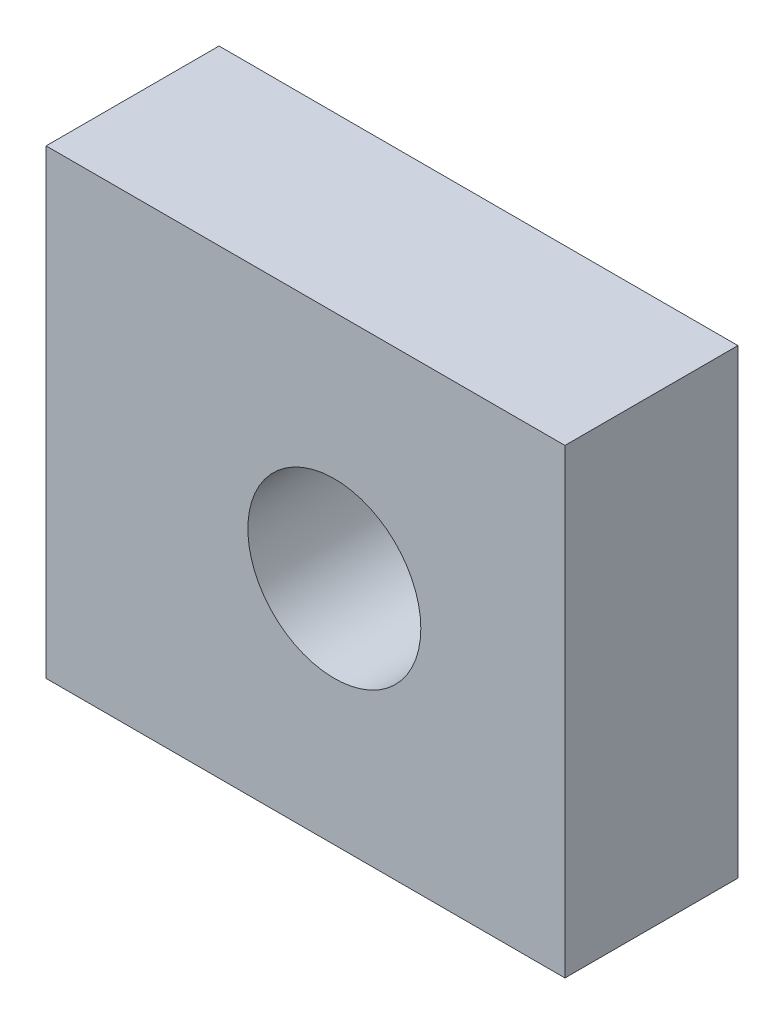
from build123d import *

# Parameters (mm, degrees)
SKETCH_1_W          = 9
SKETCH_1_H          = 8
EXTRUDE_1_DEPTH     = 3
SKETCH_2_R          = 1.5
CUT_EXTRUDE_1_DEPTH = 13.409673646


with BuildPart() as part:
    # Эскиз1 → Бобышка-Вытянуть1 (new body)
    with BuildSketch(Plane.XY):
        with Locations((4.5, 4)):
            Rectangle(SKETCH_1_W, SKETCH_1_H)
    extrude(amount=EXTRUDE_1_DEPTH)

    # Эскиз2 → Вырез-Вытянуть1 (cut, through all)
    with BuildSketch(Plane.XY.offset(3)):
        with Locations((5, 4)):
            Circle(SKETCH_2_R)
    extrude(amount=-CUT_EXTRUDE_1_DEPTH, mode=Mode.SUBTRACT)


solid = part.part
